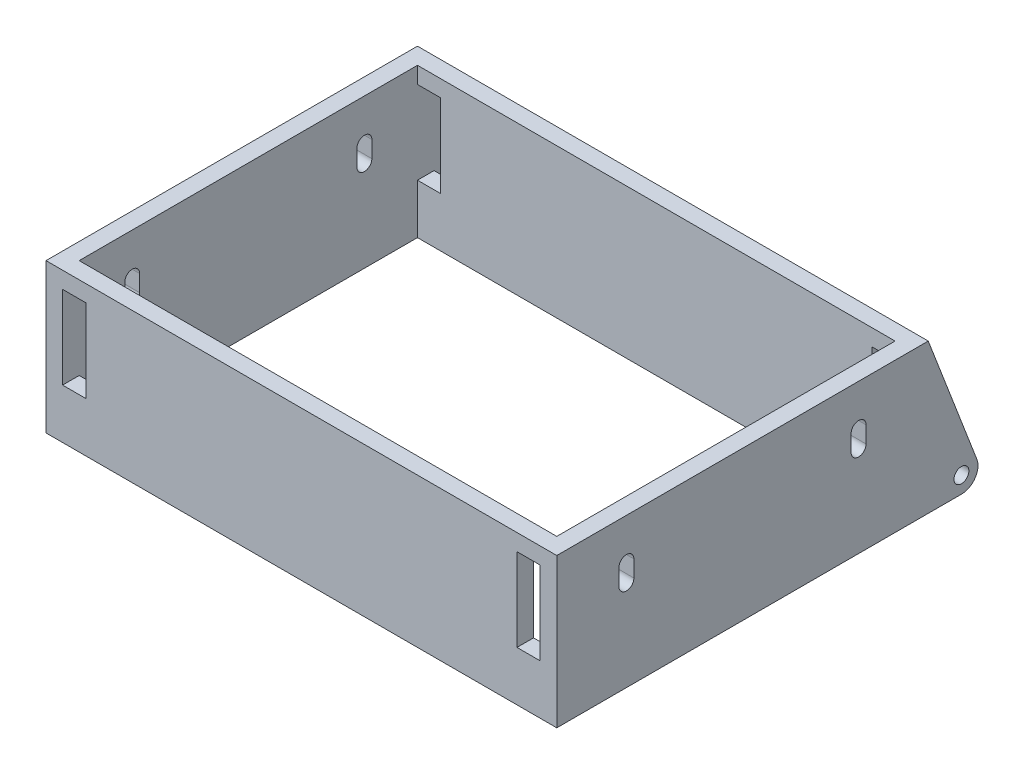
from build123d import *

# Parameters (mm, degrees)
SKETCH1_W               = 154
SKETCH1_H               = 112
SKETCH1_W_2             = 144
SKETCH1_H_2             = 102
BOSS_EXTRUDE1_DEPTH     = 45
CUT_EXTRUDE1_DEPTH      = 180.5
SKETCH3_W               = 7
SKETCH3_H               = 25
CUT_EXTRUDE3_DEPTH      = 134
SKETCH4_R               = 2.25
BOSS_EXTRUDE2_DEPTH     = 5
LPATTERN1_COUNT         = 2
LPATTERN1_PITCH         = 12
MIRROR1_COPY_1_SKETCH_R = 2.25
MIRROR1_COPY_1_DEPTH    = 5


with BuildPart() as part:
    # Sketch1 → Boss-Extrude1 (new body)
    with BuildSketch(Plane(origin=(0, 0, 0), x_dir=(1, 0, 0), z_dir=(0, 1, 0))):
        Rectangle(SKETCH1_W, SKETCH1_H)
        Rectangle(SKETCH1_W_2, SKETCH1_H_2, mode=Mode.SUBTRACT)
    extrude(amount=BOSS_EXTRUDE1_DEPTH)

    # Sketch2 → Cut-Extrude1 (cut)
    with BuildSketch(Plane.ZY.offset(77)):
        with BuildLine():
            Line((-32.75, 32.5), (-32.75, 27.5))
            ThreePointArc((-32.75, 27.5), (-35, 25.25), (-37.25, 27.5))
            Line((-37.25, 27.5), (-37.25, 32.5))
            ThreePointArc((-37.25, 32.5), (-35, 34.75), (-32.75, 32.5))
        make_face()
        with BuildLine():
            Line((37.25, 32.5), (37.25, 27.5))
            ThreePointArc((37.25, 27.5), (35, 25.25), (32.75, 27.5))
            Line((32.75, 27.5), (32.75, 32.5))
            ThreePointArc((32.75, 32.5), (35, 34.75), (37.25, 32.5))
        make_face()
    extrude(amount=-CUT_EXTRUDE1_DEPTH, mode=Mode.SUBTRACT)

    # Sketch3 → Cut-Extrude3 (cut)
    with BuildSketch(Plane(origin=(0, 0, -56), x_dir=(-1, 0, 0), z_dir=(0, 0, -1))):
        with Locations((-68.5, 27.5)):
            Rectangle(SKETCH3_W, SKETCH3_H)
        with Locations((68.5, 27.5)):
            Rectangle(SKETCH3_W, SKETCH3_H)
    extrude(amount=-CUT_EXTRUDE3_DEPTH, mode=Mode.SUBTRACT)

    # Sketch4 → Boss-Extrude2 (add)
    with BuildSketch(Plane.ZY.offset(77)):
        with BuildLine():
            Line((-66, 0), (-56, 0))
            Line((-56, 0), (-56, 45))
            Line((-56, 45), (-70.667854572, 6.791963643))
            ThreePointArc((-70.667854572, 6.791963643), (-70.120668527, 2.168023501), (-66, 0))
        make_face()
        with Locations((-66, 5)):
            Circle(SKETCH4_R, mode=Mode.SUBTRACT)
    boss_extrude2 = extrude(amount=-BOSS_EXTRUDE2_DEPTH)

    # LPattern1: Boss-Extrude2 ×2
    with Locations(*[(i * LPATTERN1_PITCH, 0, 0) for i in range(1, LPATTERN1_COUNT)]):
        add(boss_extrude2)

    # Mirror1: Boss-Extrude2 across plane
    add(boss_extrude2.mirror(Plane(origin=(0, 0, 0), x_dir=(0, 0, 1), z_dir=(1, 0, 0))))

    # Mirror1 copy 1 sketch → Mirror1 copy 1 (add)
    with BuildSketch(Plane(origin=(65, 0, 0), x_dir=(0, 0, 1), z_dir=(1, 0, 0))):
        with BuildLine():
            Line((-66, 0), (-56, 0))
            Line((-56, 0), (-56, -45))
            Line((-56, -45), (-70.667854572, -6.791963643))
            ThreePointArc((-70.667854572, -6.791963643), (-70.120668527, -2.168023501), (-66, 0))
        make_face()
        with Locations((-66, -5)):
            Circle(MIRROR1_COPY_1_SKETCH_R, mode=Mode.SUBTRACT)
    extrude(amount=-MIRROR1_COPY_1_DEPTH)


solid = part.part
